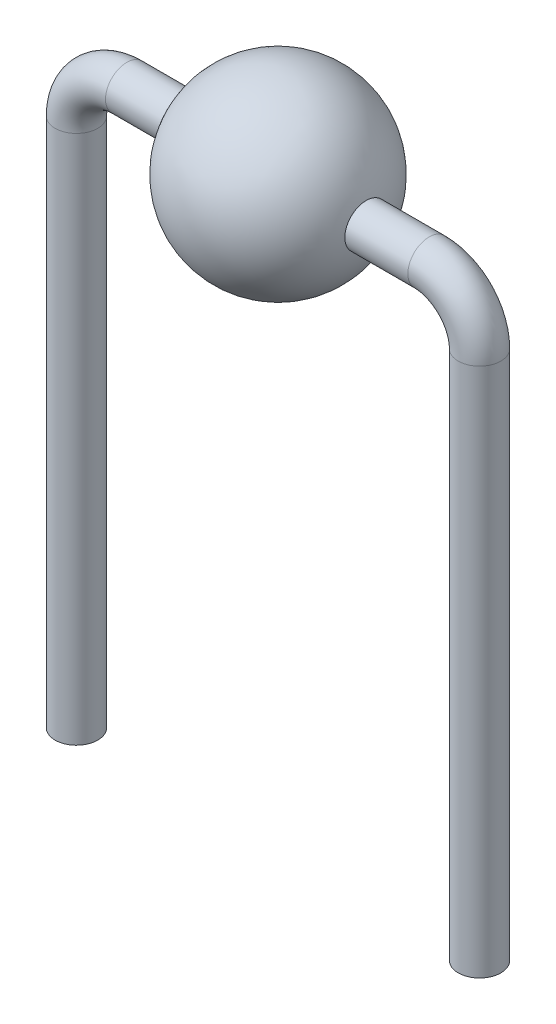
from build123d import *

# Parameters (mm, degrees)
SKETCH_3_R = 0.423054932


with BuildPart() as part:
    # Эскиз1 → Повернуть2 (revolve)
    with BuildSketch(Plane(origin=(0, 0, 0), x_dir=(1, 0, 0), z_dir=(0, 1, 0))):
        with BuildLine():
            ThreePointArc((-1.749578385, 0.423054932), (0, 1.8), (1.749578385, 0.423054932))
            Line((1.749578385, 0.423054932), (1.749578385, 0))
            Line((1.749578385, 0), (-1.749578385, 0))
            Line((-1.749578385, 0), (-1.749578385, 0.423054932))
        make_face()
    revolve(axis=Axis((-29.751182373, 0, 0), (1, 0, 0)))

    # По траектории1: sweep along a path in Эскиз2
    with BuildLine(Plane.XY) as sweep_1_path:
        Line((0, 0), (-3, 0))
        ThreePointArc((-3, 0), (-3.707106781, -0.292893219), (-4, -1))
        Line((-4, -1), (-4, -11.514871198))
    # Эскиз3 → По траектории1 (sweep)
    with BuildSketch(Plane.ZY.offset(1.749578385)):
        Circle(SKETCH_3_R)
    sweep_1 = sweep(path=sweep_1_path.line)

    # Зеркальное отражение1: По траектории1 across plane
    add(sweep_1.mirror(Plane(origin=(0, 0, 0), x_dir=(0, 0, 1), z_dir=(1, 0, 0))))


solid = part.part
